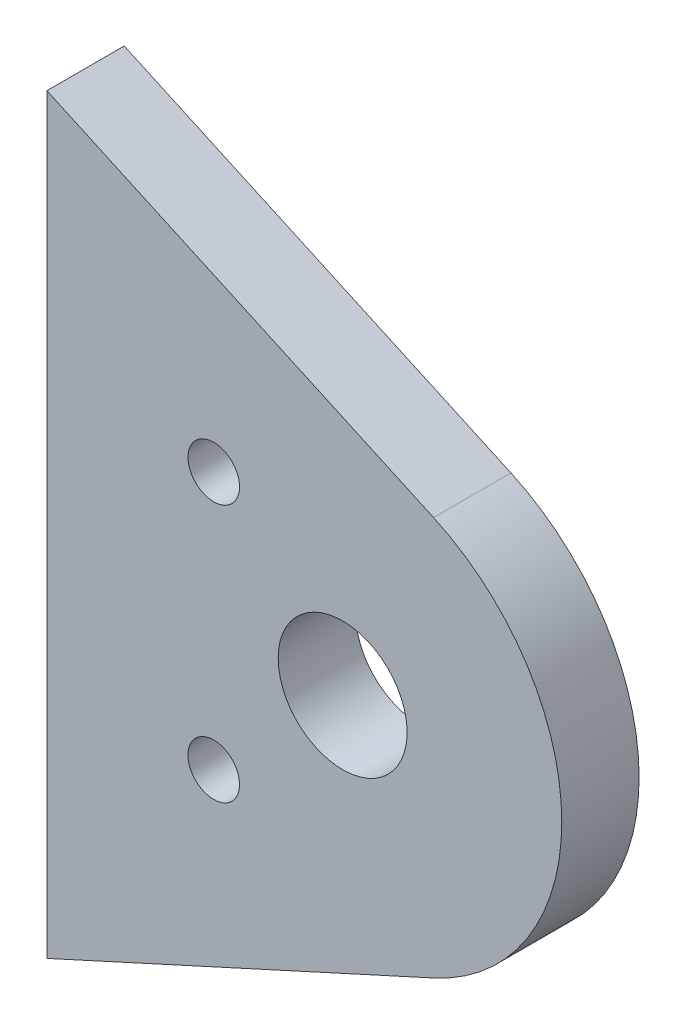
from build123d import *

# Parameters (mm, degrees)
ESQUISSE1_R                  = 19.25
ESQUISSE1_R_2                = 2.5
BOSS_EXTRU_1_DEPTH           = 42
ENL_V_MAT_EXTRU_1_DEPTH      = 74.881298321
ENL_V_MAT_EXTRU_1_DEPTH_BACK = 74.881298321
ESQUISSE2_W                  = 90
ESQUISSE2_H                  = 30
ESQUISSE3_R                  = 1
ENL_V_MAT_EXTRU_2_DEPTH      = 42
ENL_V_MAT_EXTRU_3_DEPTH      = 78.729096869
ENL_V_MAT_EXTRU_3_DEPTH_BACK = 78.729096869
ESQUISSE4_W                  = 87.75
ESQUISSE4_H                  = 33
ESQUISSE4_H_2                = 6


with BuildPart() as part:
    # Esquisse1 → Boss.-Extru.1 (new body)
    with BuildSketch(Plane.XY):
        with BuildLine():
            Line((12.13875, 26.612276273), (53.5275, 7.733481994))
            ThreePointArc((53.5275, 7.733481994), (58.5, 0), (53.5275, -7.733481994))
            Line((53.5275, -7.733481994), (12.13875, -26.612276273))
            ThreePointArc((12.13875, -26.612276273), (-29.25, 0), (12.13875, 26.612276273))
        make_face()
        with Locations(Location((0, 0, 0), (0, 0, 180))):
            Circle(ESQUISSE1_R, mode=Mode.SUBTRACT)
        with Locations(Location((50, 0, 0), (0, 0, 180))):
            Circle(ESQUISSE1_R_2, mode=Mode.SUBTRACT)
    extrude(amount=BOSS_EXTRU_1_DEPTH)

    # Esquisse2 → Enlèv. mat.-Extru.1 (cut, two sides: drawn at the far end of the back side and taken through both)
    with BuildSketch(Plane(origin=(5.218823759, 0, 0), x_dir=(1, 0, 0), z_dir=(0, 1, 0)).offset(-ENL_V_MAT_EXTRU_1_DEPTH_BACK)):
        with Locations((-11.691323759, -21)):
            Rectangle(ESQUISSE2_W, ESQUISSE2_H)
    extrude(amount=ENL_V_MAT_EXTRU_1_DEPTH + ENL_V_MAT_EXTRU_1_DEPTH_BACK, mode=Mode.SUBTRACT)

    # Esquisse3 → Enlèv. mat.-Extru.2 (cut)
    with BuildSketch(Plane.XY.offset(42)):
        with Locations((45, 5)):
            Circle(ESQUISSE3_R)
        with Locations((45, -5)):
            Circle(ESQUISSE3_R)
        with Locations((-15, 19)):
            Circle(ESQUISSE3_R)
        with Locations((-15, -19)):
            Circle(ESQUISSE3_R)
    extrude(amount=-ENL_V_MAT_EXTRU_2_DEPTH, mode=Mode.SUBTRACT)

    # Esquisse4 → Enlèv. mat.-Extru.3 (cut, two sides: drawn at the far end of the back side and taken through both)
    with BuildSketch(Plane(origin=(0, 0, 0), x_dir=(1, 0, 0), z_dir=(0, 1, 0)).offset(-ENL_V_MAT_EXTRU_3_DEPTH_BACK)):
        with Locations((14.625, -25.5)):
            Rectangle(ESQUISSE4_W, ESQUISSE4_H)
        with Locations((14.625, -3)):
            Rectangle(ESQUISSE4_W, ESQUISSE4_H_2)
    extrude(amount=ENL_V_MAT_EXTRU_3_DEPTH + ENL_V_MAT_EXTRU_3_DEPTH_BACK, mode=Mode.SUBTRACT)


solid = part.part
